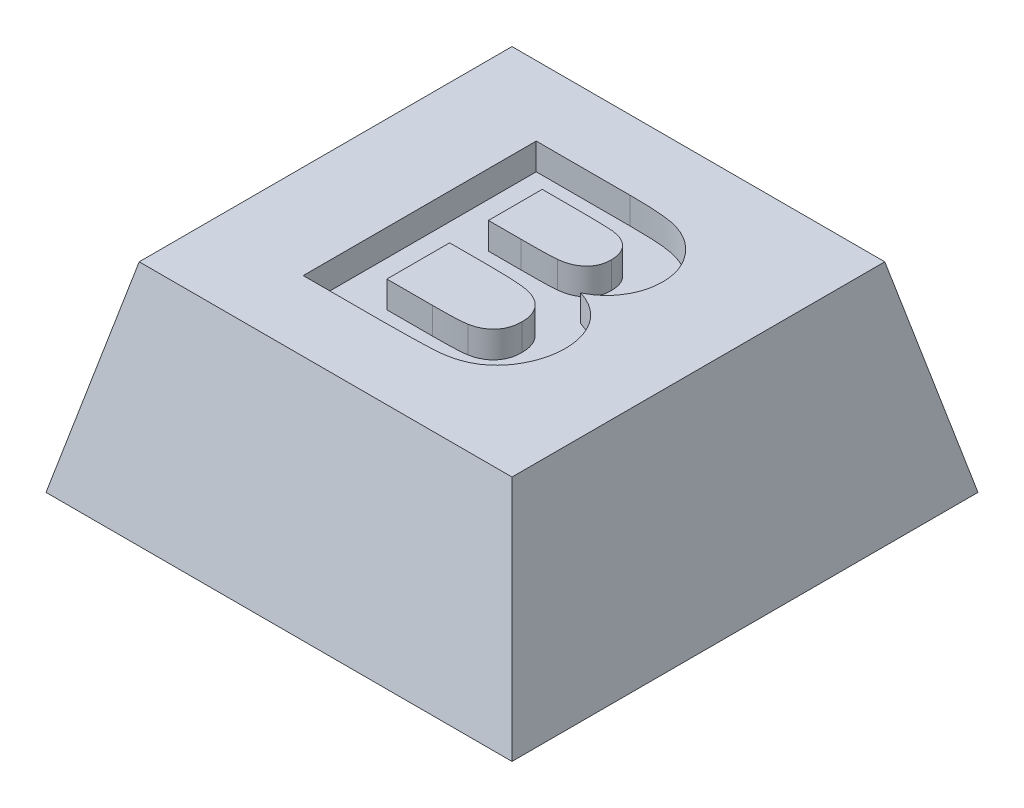
from build123d import *

# Parameters (mm, degrees)
SKETCH1_W           = 7
SKETCH1_H           = 7
BOSS_EXTRUDE1_DEPTH = 3
CUT_EXTRUDE1_DEPTH  = 7
CUT_EXTRUDE2_DEPTH  = 11
SKETCH4_R           = 1.8
CUT_EXTRUDE3_DEPTH  = 0.8
CUT_EXTRUDE4_DEPTH  = 0.4


with BuildPart() as part:
    # Sketch1 → Boss-Extrude1 (new body)
    with BuildSketch(Plane(origin=(0, 0, 0), x_dir=(1, 0, 0), z_dir=(0, 1, 0))):
        with Locations((3.5, 3.5)):
            Rectangle(SKETCH1_W, SKETCH1_H)
    extrude(amount=BOSS_EXTRUDE1_DEPTH)

    # Sketch2 → Cut-Extrude1 (cut)
    with BuildSketch(Plane.XY):
        Polygon((0, 0), (0.7, 3), (0, 3), align=None)
        Polygon((7, 0), (6.3, 3), (7, 3), align=None)
    extrude(amount=-CUT_EXTRUDE1_DEPTH, mode=Mode.SUBTRACT)

    # Sketch3 → Cut-Extrude2 (cut)
    with BuildSketch(Plane(origin=(0, 0, 0), x_dir=(0, 0, -1), z_dir=(1, 0, 0))):
        Polygon((0, 0), (0.7, 3), (0, 3), align=None)
        Polygon((7, 3), (6.3, 3), (7, 0), align=None)
    extrude(amount=CUT_EXTRUDE2_DEPTH, mode=Mode.SUBTRACT)

    # Sketch4 → Cut-Extrude3 (cut)
    with BuildSketch(Plane.XZ):
        with Locations(Location((3.5, -3.5, 0), (0, 0, 270))):
            Circle(SKETCH4_R)
    extrude(amount=-CUT_EXTRUDE3_DEPTH, mode=Mode.SUBTRACT)

    # Sketch5 → Cut-Extrude4 (cut)
    with BuildSketch(Plane(origin=(0, 3, 0), x_dir=(1, 0, 0), z_dir=(0, 1, 0))):
        with BuildLine():
            Line((2.111509743, 5.252535384), (3.521465672, 5.252535384))
            add(Edge.make_bspline(
                [(3.521465672, 5.252535384), (3.555352929, 5.252333756), (3.620793103, 5.251944389), (3.715699078, 5.250859268), (3.803790562, 5.247672529), (3.88520473, 5.244936095), (3.959670809, 5.238536714), (4.027774054, 5.233508957), (4.089300044, 5.226592072), (4.161779262, 5.215398498), (4.246059792, 5.197987684), (4.341252586, 5.165782389), (4.43148602, 5.125545022), (4.515403802, 5.074389368), (4.593284686, 5.014559615), (4.665724305, 4.946532312), (4.729381186, 4.867558536), (4.786703202, 4.781364769), (4.835087081, 4.687878618), (4.868405373, 4.587306133), (4.88966817, 4.481491325), (4.892245345, 4.408956406), (4.893561025, 4.37192641)],
                knots=[0, 0, 0, 0, 1.096610875, 2.117681168, 3.071055591, 3.949137991, 4.753059115, 5.489127199, 6.15892391, 6.75575099, 7.862330316, 8.938514814, 10.001276227, 11.05313779, 12.110449801, 13.174958802, 14.260456508, 15.384725817, 16.521138801, 17.654729897, 18.802709851, 20, 20, 20, 20], degree=3))
            add(Edge.make_bspline(
                [(4.893561025, 4.37192641), (4.892196479, 4.331601681), (4.889505896, 4.252090262), (4.864462524, 4.135494667), (4.824571342, 4.023939737), (4.768250724, 3.919235161), (4.699269413, 3.823150089), (4.617676049, 3.738775738), (4.524669493, 3.666625119), (4.454832509, 3.630722743), (4.419602692, 3.612611506)],
                knots=[0, 0, 0, 0, 1.023065178, 2.01725758, 3.014298905, 4.023406433, 5.026736079, 6.009055718, 6.99565244, 8, 8, 8, 8], degree=3))
            add(Edge.make_bspline(
                [(4.419602692, 3.612611506), (4.443330648, 3.604529528), (4.490246921, 3.588549379), (4.557400348, 3.559205258), (4.620319472, 3.52517498), (4.678972699, 3.487531632), (4.733805186, 3.446000029), (4.783214944, 3.399203081), (4.83003713, 3.349803196), (4.871143379, 3.295320645), (4.908350842, 3.238361247), (4.939934418, 3.17803347), (4.967283165, 3.115788352), (4.990155428, 3.050995933), (5.006459358, 2.983221651), (5.019523083, 2.913319286), (5.02620612, 2.840804369), (5.027514255, 2.791842338), (5.02817641, 2.767058621)],
                knots=[0, 0, 0, 0, 1.072651974, 2.1209089, 3.132484228, 4.131466326, 5.101889999, 6.071643115, 7.041396231, 8.011819904, 8.988565287, 9.95070344, 10.922775742, 11.897213062, 12.887138018, 13.903598663, 14.938838629, 16, 16, 16, 16], degree=3))
            add(Edge.make_bspline(
                [(5.02817641, 2.767058621), (5.026768086, 2.727480727), (5.02395794, 2.64850764), (5.002958076, 2.530696633), (4.96749134, 2.414960489), (4.919462058, 2.302050025), (4.859804392, 2.195584607), (4.789667704, 2.098381872), (4.707836651, 2.01380613), (4.617215838, 1.939282584), (4.515099833, 1.877587714), (4.401575881, 1.830197397), (4.277361379, 1.794394944), (4.18985285, 1.782501682), (4.144762948, 1.776373525)],
                knots=[0, 0, 0, 0, 0.975059807, 1.945618526, 2.93861228, 3.952760547, 4.963632603, 5.940527786, 6.897802811, 7.855787948, 8.824773195, 9.82606706, 10.879852914, 12, 12, 12, 12], degree=3))
            add(Edge.make_bspline(
                [(4.144762948, 1.776373525), (4.127472996, 1.774915024), (4.087782581, 1.771566924), (4.020469845, 1.767404325), (3.937705498, 1.764257864), (3.839561406, 1.760537572), (3.725735437, 1.757851413), (3.596486285, 1.756017129), (3.451593418, 1.75363659), (3.349925557, 1.752915159), (3.296405576, 1.752535384)],
                knots=[0, 0, 0, 0, 0.490565993, 1.126131979, 1.906526787, 2.832178623, 3.902933831, 5.125497984, 6.486805064, 8, 8, 8, 8], degree=3))
            Line((3.296405576, 1.752535384), (2.111509743, 1.752535384))
            Line((2.111509743, 1.752535384), (2.111509743, 5.252535384))
        make_face()
        with BuildLine():
            Line((2.784586666, 4.669202051), (2.784586666, 3.861509743))
            Line((2.784586666, 3.861509743), (3.271866313, 3.861509743))
            add(Edge.make_bspline(
                [(3.271866313, 3.861509743), (3.306221586, 3.861434055), (3.371661079, 3.861289884), (3.464674551, 3.862255994), (3.547646114, 3.862707017), (3.620337221, 3.8640307), (3.682732948, 3.866215267), (3.734608475, 3.868396735), (3.776263571, 3.870048358), (3.800518366, 3.872406802), (3.811028974, 3.873428813)],
                knots=[0, 0, 0, 0, 1.528479216, 2.911428072, 4.138414629, 5.21998762, 6.145918986, 6.915989543, 7.530253335, 8, 8, 8, 8], degree=3))
            add(Edge.make_bspline(
                [(3.811028974, 3.873428813), (3.841339923, 3.877989922), (3.899595708, 3.886756091), (3.981115359, 3.912443032), (4.051822858, 3.949594446), (4.112503082, 3.995838149), (4.16067052, 4.052573755), (4.196017974, 4.117840239), (4.216698833, 4.191911851), (4.219190867, 4.243956456), (4.220484102, 4.270964871)],
                knots=[0, 0, 0, 0, 1.162079002, 2.233444551, 3.225172046, 4.179556897, 5.110707885, 6.027301426, 6.976273101, 8, 8, 8, 8], degree=3))
            add(Edge.make_bspline(
                [(4.220484102, 4.270964871), (4.219672292, 4.297045189), (4.21811382, 4.347112917), (4.198753979, 4.418001877), (4.169647913, 4.481665844), (4.127102602, 4.536540746), (4.073714805, 4.582883197), (4.008370927, 4.619083019), (3.931384749, 4.643991925), (3.875931131, 4.652704095), (3.846786185, 4.65728298)],
                knots=[0, 0, 0, 0, 1.044241546, 2.004684189, 2.928111627, 3.838334562, 4.769594837, 5.748424953, 6.81663206, 8, 8, 8, 8], degree=3))
            add(Edge.make_bspline(
                [(3.846786185, 4.65728298), (3.835340353, 4.658308087), (3.808280354, 4.660731624), (3.761249742, 4.662307099), (3.701429573, 4.664524478), (3.628514928, 4.666688526), (3.542503834, 4.668009799), (3.443640912, 4.668455112), (3.331930575, 4.669425441), (3.253169995, 4.669279261), (3.211569839, 4.669202051)],
                knots=[0, 0, 0, 0, 0.433943041, 1.02591908, 1.776648879, 2.694999143, 3.780816848, 5.02540149, 6.428861738, 8, 8, 8, 8], degree=3))
            Line((3.211569839, 4.669202051), (2.784586666, 4.669202051))
        make_face(mode=Mode.SUBTRACT)
        with BuildLine():
            Line((2.784586666, 3.27817641), (2.784586666, 2.335868717))
            Line((2.784586666, 2.335868717), (3.471686025, 2.335868717))
            add(Edge.make_bspline(
                [(3.471686025, 2.335868717), (3.503705507, 2.335709884), (3.564476207, 2.33540843), (3.651169443, 2.337427531), (3.728560529, 2.338093302), (3.79701169, 2.341414873), (3.856163227, 2.343927607), (3.906258531, 2.347060152), (3.946906458, 2.352041803), (3.970893783, 2.355909309), (3.98140157, 2.357603493)],
                knots=[0, 0, 0, 0, 1.504773752, 2.85595359, 4.075347731, 5.141676974, 6.076328919, 6.858106537, 7.499786952, 8, 8, 8, 8], degree=3))
            add(Edge.make_bspline(
                [(3.98140157, 2.357603493), (4.008085962, 2.36323372), (4.059931656, 2.374172812), (4.13178912, 2.405562615), (4.196552287, 2.445370583), (4.252642198, 2.496532162), (4.298745197, 2.557822327), (4.332034841, 2.629376077), (4.352110737, 2.710351547), (4.354073968, 2.767404519), (4.355099486, 2.797206858)],
                knots=[0, 0, 0, 0, 1.031056579, 2.003262591, 2.954260215, 3.900917722, 4.862741126, 5.841340256, 6.872396835, 8, 8, 8, 8], degree=3))
            add(Edge.make_bspline(
                [(4.355099486, 2.797206858), (4.354271867, 2.82276493), (4.352661002, 2.872510733), (4.336892789, 2.943762046), (4.311385128, 3.008909067), (4.275862523, 3.067507228), (4.231481376, 3.120292471), (4.17661735, 3.164466336), (4.113275558, 3.201270071), (4.052892173, 3.225515958), (3.995633073, 3.241071138), (3.941019912, 3.251275641), (3.875199891, 3.25935328), (3.798492104, 3.266186067), (3.710585277, 3.271650146), (3.611715662, 3.275957666), (3.501607357, 3.277760533), (3.424477404, 3.278033382), (3.384045801, 3.27817641)],
                knots=[0, 0, 0, 0, 0.992165387, 1.931134082, 2.820086661, 3.700270762, 4.583075858, 5.486803518, 6.423132184, 7.421722103, 8.005700193, 8.727213115, 9.57900282, 10.582332745, 11.720121093, 13.002085041, 14.428489784, 16, 16, 16, 16], degree=3))
            Line((3.384045801, 3.27817641), (2.784586666, 3.27817641))
        make_face(mode=Mode.SUBTRACT)
    extrude(amount=-CUT_EXTRUDE4_DEPTH, mode=Mode.SUBTRACT)


solid = part.part
